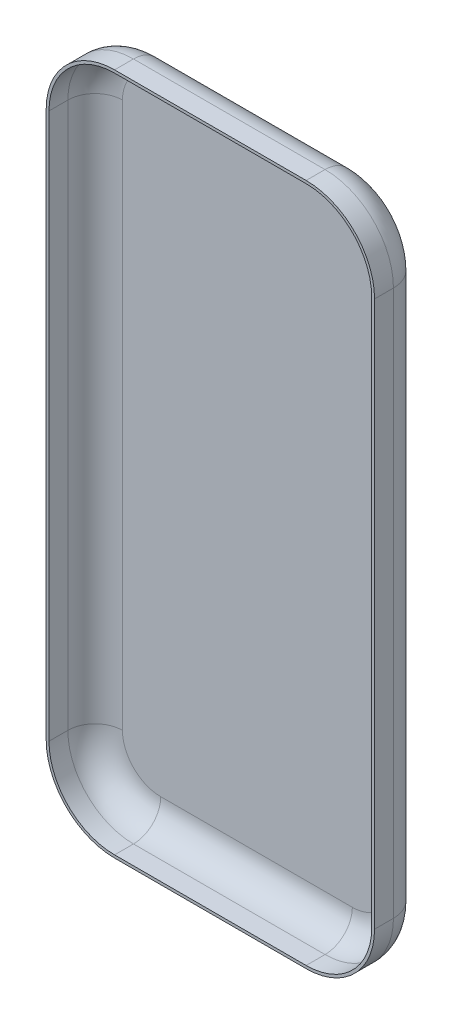
from build123d import *

# Parameters (mm, degrees)
SKETCH1_W           = 47.6758
SKETCH1_H           = 68.834
BOSS_EXTRUDE1_DEPTH = 7.112
SKETCH11_W          = 47.6758
SKETCH11_H          = 7.112
BOSS_EXTRUDE2_DEPTH = 30.2768
FILLET3_R           = 9.9314
FILLET6_R           = 4.3688
SHELL1_T            = -0.4064


with BuildPart() as part:
    # Sketch1 → Boss-Extrude1 (new body)
    with BuildSketch(Plane.XY):
        with Locations((0, -34.417)):
            Rectangle(SKETCH1_W, SKETCH1_H)
    extrude(amount=-BOSS_EXTRUDE1_DEPTH)

    # Sketch11 → Boss-Extrude2 (add)
    with BuildSketch(Plane(origin=(0, 0, 0), x_dir=(1, 0, 0), z_dir=(0, 1, 0))):
        with Locations((0, 3.556)):
            Rectangle(SKETCH11_W, SKETCH11_H)
    extrude(amount=BOSS_EXTRUDE2_DEPTH)

    # Fillet3
    fillet3_edges = [part.edges().sort_by_distance(p)[0] for p in [
        (-23.8379, 30.2768, -3.556),
        (23.8379, 30.2768, -3.556),
        (23.8379, -68.834, -3.556),
        (-23.8379, -68.834, -3.556),
    ]]
    fillet(fillet3_edges, radius=FILLET3_R)

    # Fillet6
    fillet6_edges = [part.edges().sort_by_distance(p)[0] for p in [
        (-23.8379, -19.2786, -7.112),
        (-20.929060287, -65.925160287, -7.112),
        (0, -68.834, -7.112),
        (23.8379, -19.2786, -7.112),
        (-20.929060287, 27.367960287, -7.112),
        (0, 30.2768, -7.112),
        (20.929060287, 27.367960287, -7.112),
    ]]
    fillet(fillet6_edges, radius=FILLET6_R)

    # Shell1
    shell1_openings = [part.faces().sort_by_distance(p)[0] for p in [
        (0, -19.2786, 0),
    ]]
    offset(amount=SHELL1_T, openings=shell1_openings, kind=Kind.INTERSECTION)


solid = part.part
